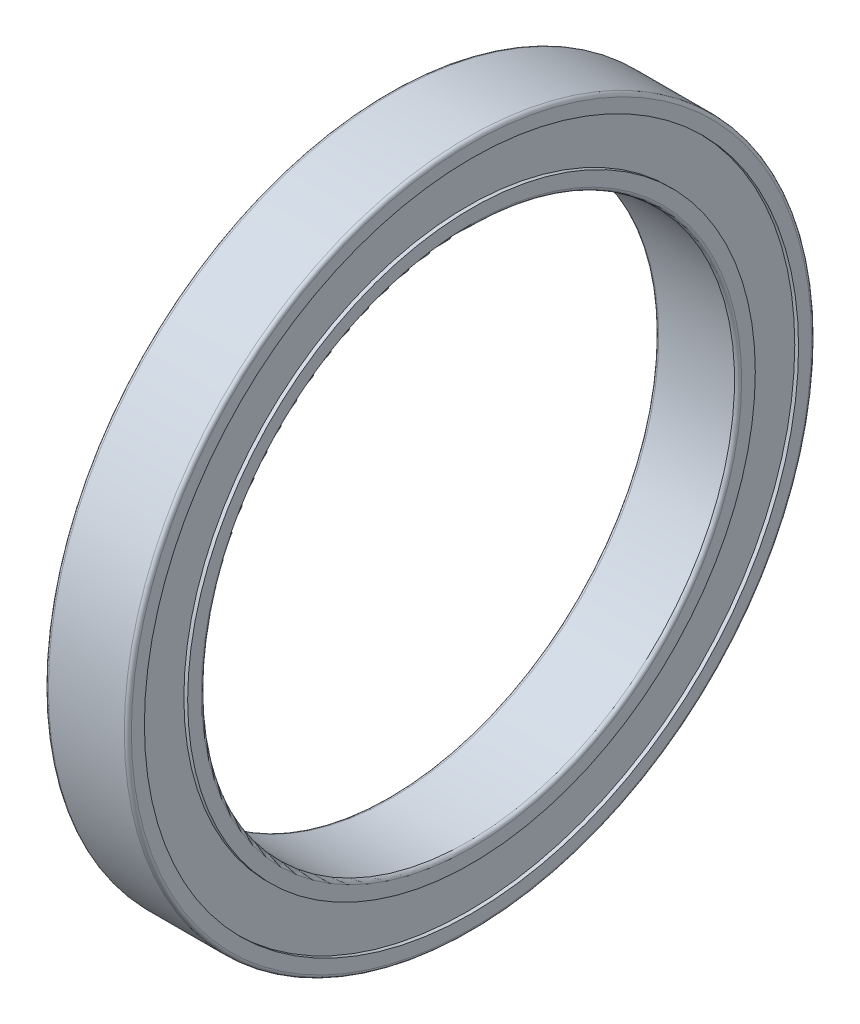
from build123d import *

# Parameters (mm, degrees)
FILLET1_R = 0.3
FILLET2_R = 0.3


with BuildPart() as part:
    # Sketch1 → Revolve1 (revolve)
    with BuildSketch(Plane.XY, mode=Mode.PRIVATE) as revolve1_sk:
        Polygon((0, 22.5), (7, 22.5), (7, 23.95), (6.68, 23.95), (6.68, 27.6), (7, 27.6), (7, 29), (0, 29), (0, 27.6), (0.32, 27.6), (0.32, 23.95), (0, 23.95), align=None)
    revolve(revolve1_sk.sketch.rotate(Axis((0, 0, 0), (1, 0, 0)), 90), axis=Axis((0, 0, 0), (1, 0, 0)))

    # Fillet1
    fillet1_edges = [part.edges().sort_by_distance(p)[0] for p in [
        (0, 0, -29),
        (7, 0, -29),
    ]]
    fillet(fillet1_edges, radius=FILLET1_R)

    # Fillet2
    fillet2_edges = [part.edges().sort_by_distance(p)[0] for p in [
        (7, 0, -22.5),
        (0, 0, -22.5),
    ]]
    fillet(fillet2_edges, radius=FILLET2_R)


solid = part.part
